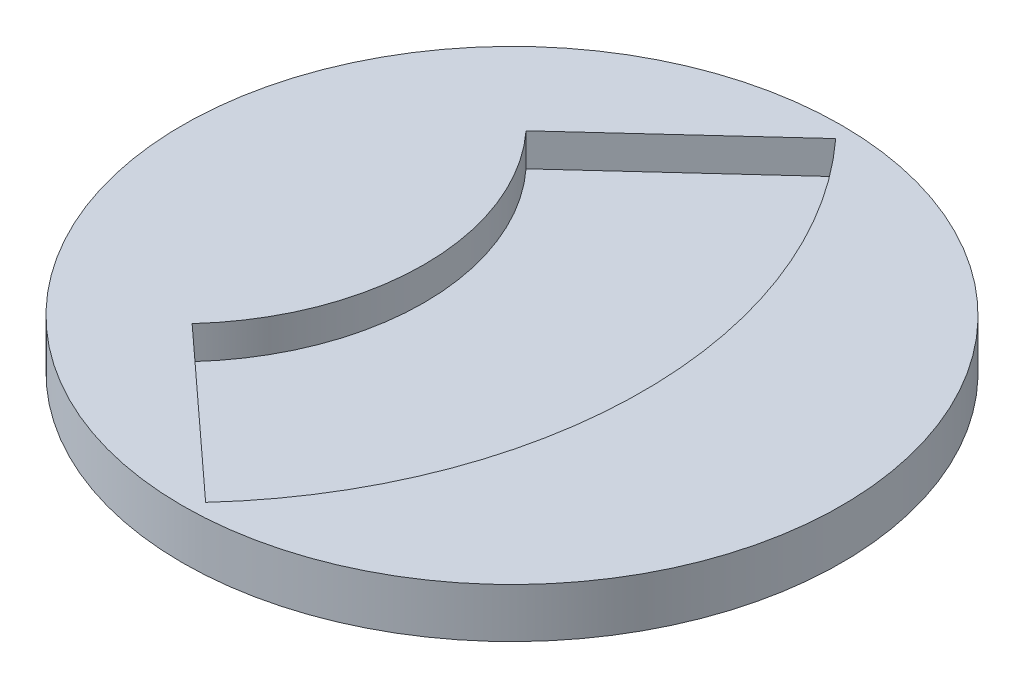
from build123d import *

# Parameters (mm, degrees)
CUT_EXTRUDE1_DEPTH = 2


with BuildPart() as part:
    # Sketch1 → Revolve1 (revolve)
    with BuildSketch(Plane.XY, mode=Mode.PRIVATE) as revolve1_sk:
        Polygon((0.9, -2), (0.9, 2), (0, 2), (0, 5), (20, 5), (20, 2), (2.9, 2), (2.9, -2), align=None)
    revolve(revolve1_sk.sketch.rotate(Axis((0, -3.539189189, 0), (0, 1, 0)), 90), axis=Axis((0, -3.539189189, 0), (0, 1, 0)))

    # Sketch2 → Cut-Extrude1 (cut)
    with BuildSketch(Plane(origin=(0, 5, 0), x_dir=(1, 0, 0), z_dir=(0, 1, 0))):
        with BuildLine():
            Line((0.526272079, 19.119202876), (-9.2795165, 10.133853114))
            ThreePointArc((-9.2795165, 10.133853114), (-5.338676553, 0), (-9.2795165, -10.133853114))
            Line((-9.2795165, -10.133853114), (0.526272079, -19.119202876))
            ThreePointArc((0.526272079, -19.119202876), (7.961323447, 0), (0.526272079, 19.119202876))
        make_face()
    extrude(amount=-CUT_EXTRUDE1_DEPTH, mode=Mode.SUBTRACT)


solid = part.part
